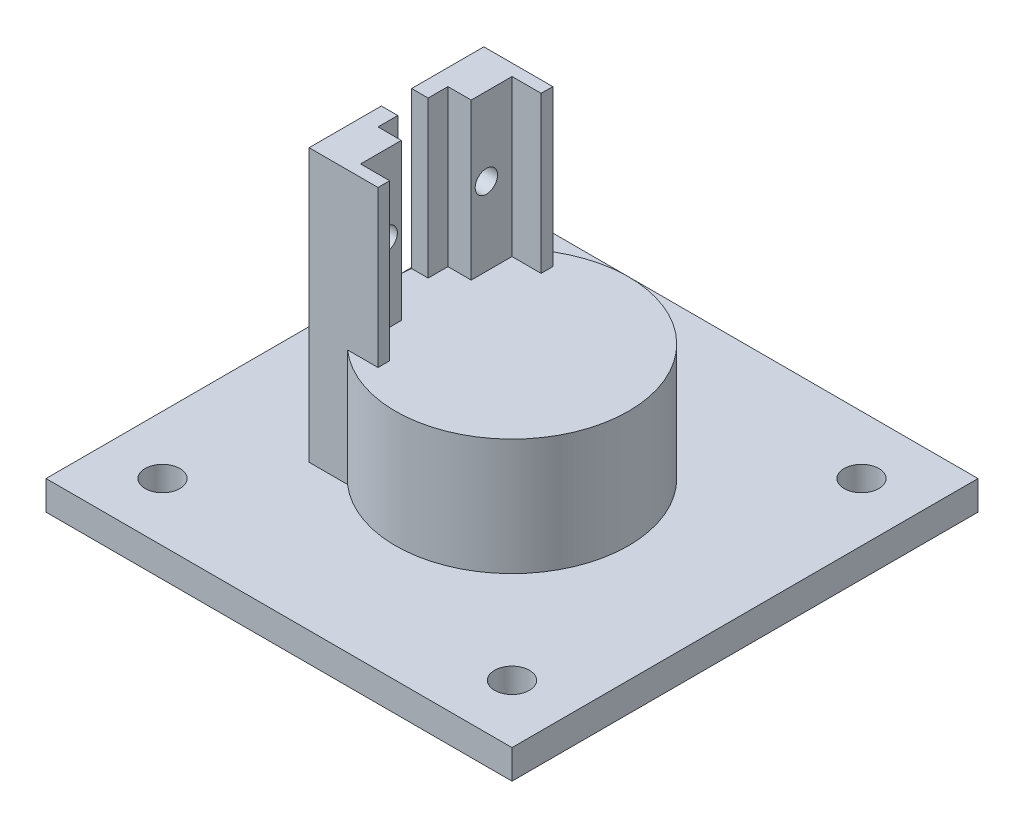
from build123d import *

# Parameters (mm, degrees)
SKETCH1_R                 = 12.7
BOSS_EXTRUDE1_DEPTH       = 12.7
BOSS_EXTRUDE2_DEPTH       = 17
CUT_EXTRUDE3_DEPTH        = 17
BOSS_EXTRUDE4_REACH       = 36.708
F_2_CLEARANCE_HOLE1_D     = 2.4384
F_2_CLEARANCE_HOLE1_DEPTH = 25.4
F_2_CLEARANCE_HOLE1_TIP   = 0.732569267
SKETCH14_W                = 50.8
SKETCH14_H                = 50.8
BOSS_EXTRUDE7_DEPTH       = 3.175
F_6_CLEARANCE_HOLE1_D     = 3.7973
F_6_CLEARANCE_HOLE1_DEPTH = 25.4
F_6_CLEARANCE_HOLE1_TIP   = 1.140824014


with BuildPart() as part:
    # Sketch1 → Boss-Extrude1 (new body)
    with BuildSketch(Plane(origin=(0, 0, 0), x_dir=(1, 0, 0), z_dir=(0, 1, 0))):
        with Locations(Location((0, 0, 0), (0, 0, 270))):
            Circle(SKETCH1_R)
    extrude(amount=BOSS_EXTRUDE1_DEPTH)

    # Sketch7 → Boss-Extrude2 (add)
    with BuildSketch(Plane(origin=(0, 12.7, 0), x_dir=(1, 0, 0), z_dir=(0, 1, 0))):
        with BuildLine():
            ThreePointArc((-8.400260413, 9.525), (-11.575260413, 5.225260413), (-12.7, 0))
            ThreePointArc((-12.7, 0), (-11.575260413, -5.225260413), (-8.400260413, -9.525))
            Line((-8.400260413, -9.525), (-5.08, -9.525))
            Line((-5.08, -9.525), (-5.08, -8.255))
            Line((-5.08, -8.255), (-8.255, -8.255))
            Line((-8.255, -8.255), (-8.255, 8.255))
            Line((-8.255, 8.255), (-5.08, 8.255))
            Line((-5.08, 8.255), (-5.08, 9.525))
            Line((-5.08, 9.525), (-8.400260413, 9.525))
        make_face()
    extrude(amount=BOSS_EXTRUDE2_DEPTH)

    # Sketch8 → Cut-Extrude3 (cut)
    with BuildSketch(Plane(origin=(0, 29.7, 0), x_dir=(1, 0, 0), z_dir=(0, 1, 0))):
        Polygon((-8.255, -3.81), (-8.255, 3.81), (-10.795, 3.81), (-10.795, 1.651), (-12.7, 1.651), (-12.7, -1.651), (-10.795, -1.651), (-10.795, -3.81), align=None)
    extrude(amount=-CUT_EXTRUDE3_DEPTH, mode=Mode.SUBTRACT)

    # Boss-Extrude4: up to this face of the body (flat: up to its plane)
    boss_extrude4_end = Plane(part.part.faces().sort_by_distance((0, 0, 0))[0])
    # Sketch13 → Boss-Extrude4 (add, up to the picked face)
    with BuildSketch(Plane(origin=(0, 29.7, 0), x_dir=(1, 0, 0), z_dir=(0, 1, 0)), mode=Mode.PRIVATE) as boss_extrude4_sk1:
        with BuildLine():
            Line((-12.592227722, 1.651), (-12.592227722, 9.525))
            Line((-12.592227722, 9.525), (-8.400260413, 9.525))
            ThreePointArc((-8.400260413, 9.525), (-11.210312597, 5.968156456), (-12.592227722, 1.651))
        make_face()
    boss_extrude4_tool1 = split(extrude(boss_extrude4_sk1.sketch, amount=-BOSS_EXTRUDE4_REACH, mode=Mode.PRIVATE), bisect_by=boss_extrude4_end, keep=Keep.BOTH, mode=Mode.PRIVATE)
    # Sketch13 → Boss-Extrude4 (add, up to the picked face)
    with BuildSketch(Plane(origin=(0, 29.7, 0), x_dir=(1, 0, 0), z_dir=(0, 1, 0)), mode=Mode.PRIVATE) as boss_extrude4_sk2:
        with BuildLine():
            Line((-12.592227722, -1.651), (-12.592227722, -9.525))
            Line((-12.592227722, -9.525), (-8.400260413, -9.525))
            ThreePointArc((-8.400260413, -9.525), (-11.210312597, -5.968156456), (-12.592227722, -1.651))
        make_face()
    boss_extrude4_tool2 = split(extrude(boss_extrude4_sk2.sketch, amount=-BOSS_EXTRUDE4_REACH, mode=Mode.PRIVATE), bisect_by=boss_extrude4_end, keep=Keep.BOTH, mode=Mode.PRIVATE)
    add(boss_extrude4_tool1.solids().sort_by(Axis((-11.366083, 29.7, -7.381946), (0, -1, 0)))[0])
    add(boss_extrude4_tool2.solids().sort_by(Axis((-11.366083, 29.7, 7.381946), (0, -1, 0)))[0])

    # #2 Clearance Hole1
    with Locations(Plane(origin=(-8.255, 0, 0), x_dir=(0, 0, -1), z_dir=(1, 0, 0))):
        with Locations((-5.46, 21.2), (5.46, 21.2)):
            Hole(F_2_CLEARANCE_HOLE1_D / 2, depth=F_2_CLEARANCE_HOLE1_DEPTH)
            with Locations((0, 0, -(F_2_CLEARANCE_HOLE1_DEPTH + F_2_CLEARANCE_HOLE1_TIP / 2))):  # 118° drill point
                Cone(0, F_2_CLEARANCE_HOLE1_D / 2, F_2_CLEARANCE_HOLE1_TIP, mode=Mode.SUBTRACT)

    # Sketch14 → Boss-Extrude7 (add)
    with BuildSketch(Plane.XZ):
        Rectangle(SKETCH14_W, SKETCH14_H)
    extrude(amount=BOSS_EXTRUDE7_DEPTH)

    # #6 Clearance Hole1
    with Locations(Plane(origin=(0, -3.175, 0), x_dir=(-1, 0, 0), z_dir=(0, -1, 0))):
        with Locations((19.05, -19.05), (-19.05, -19.05), (-19.05, 19.05), (19.05, 19.05)):
            Hole(F_6_CLEARANCE_HOLE1_D / 2, depth=F_6_CLEARANCE_HOLE1_DEPTH)
            with Locations((0, 0, -(F_6_CLEARANCE_HOLE1_DEPTH + F_6_CLEARANCE_HOLE1_TIP / 2))):  # 118° drill point
                Cone(0, F_6_CLEARANCE_HOLE1_D / 2, F_6_CLEARANCE_HOLE1_TIP, mode=Mode.SUBTRACT)


solid = part.part
